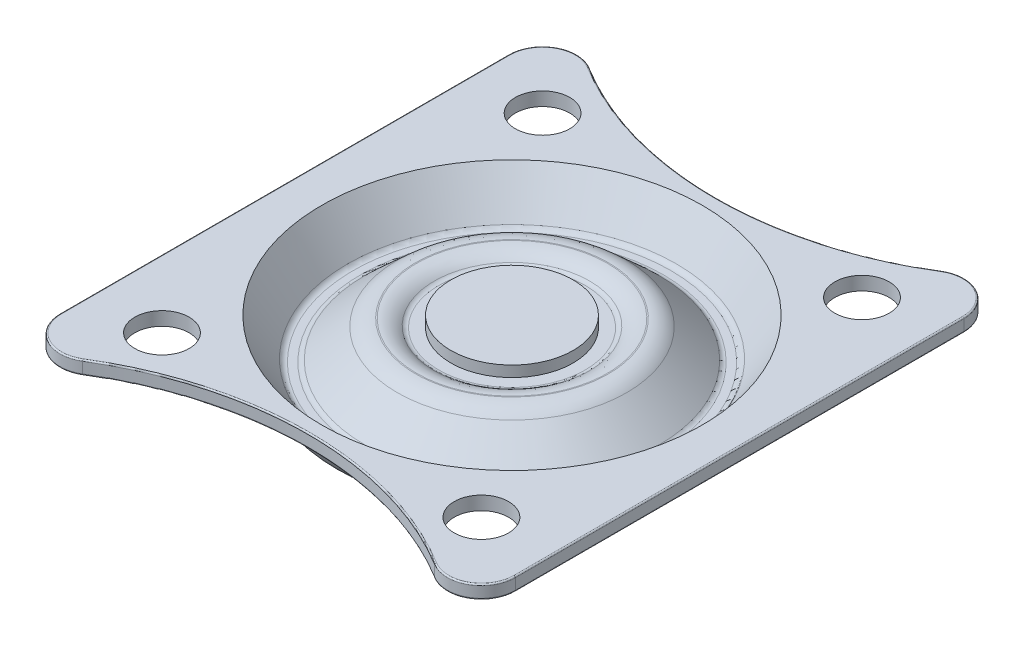
from build123d import *

# Parameters (mm, degrees)
CROQUIS1_R     = 2
EXTRUIR1_DEPTH = 1
CROQUIS4_R     = 14
EXTRUIR3_DEPTH = 26.34881654
REDONDEO1_R    = 2
REDONDEO2_R    = 0.5
REDONDEO3_R    = 2
REDONDEO6_R    = 0.1
CROQUIS2_R     = 4
EXTRUIR5_DEPTH = 26.64298157
CROQUIS5_R     = 4.5
EXTRUIR6_DEPTH = 6
CROQUIS6_R     = 5
EXTRUIR7_DEPTH = 1
REDONDEO7_R    = 0.5
MATRIZC3_COUNT = 16


with BuildPart() as part:
    # Croquis1 → Extruir1 (new body)
    with BuildSketch(Plane(origin=(0, 0, 0), x_dir=(1, 0, 0), z_dir=(0, 1, 0))):
        with BuildLine():
            Line((-16.75, -16.5), (-16.75, 16.5))
            ThreePointArc((-16.75, 16.5), (-15.474235183, 18.679735814), (-12.949001427, 18.634807418))
            ThreePointArc((-12.949001427, 18.634807418), (0, 15), (12.949001427, 18.634807418))
            ThreePointArc((12.949001427, 18.634807418), (15.474235183, 18.679735814), (16.75, 16.5))
            Line((16.75, 16.5), (16.75, -16.5))
            ThreePointArc((16.75, -16.5), (15.474235183, -18.679735814), (12.949001427, -18.634807418))
            ThreePointArc((12.949001427, -18.634807418), (0, -15), (-12.949001427, -18.634807418))
            ThreePointArc((-12.949001427, -18.634807418), (-15.474235183, -18.679735814), (-16.75, -16.5))
        make_face()
        with Locations((-11.75, -14)):
            Circle(CROQUIS1_R, mode=Mode.SUBTRACT)
        with Locations((-11.75, 14)):
            Circle(CROQUIS1_R, mode=Mode.SUBTRACT)
        with Locations((11.75, -14)):
            Circle(CROQUIS1_R, mode=Mode.SUBTRACT)
        with Locations((11.75, 14)):
            Circle(CROQUIS1_R, mode=Mode.SUBTRACT)
    extrude(amount=EXTRUIR1_DEPTH)

    # Croquis4 → Extruir3 (cut, through all)
    with BuildSketch(Plane(origin=(0, 1, 0), x_dir=(1, 0, 0), z_dir=(0, 1, 0))):
        Circle(CROQUIS4_R)
    extrude(amount=-EXTRUIR3_DEPTH, mode=Mode.SUBTRACT)

    # Croquis3 → Revolución1 (revolve)
    with BuildSketch(Plane.XY):
        Polygon((-14.527696455, 0), (-12.476697882, -3), (-10.562471246, -3), (-7.481645354, -0.2), (-6.670899824, -0.2), (-6.471898398, -0.8), (0, -0.8), (0, 0.2), (-5.75, 0.2), (-5.949001427, 0.8), (-7.868175534, 0.8), (-10.949001427, -2), (-11.949001427, -2), (-12.949001427, -0.537297861), (-14, 1), (-14, 0), align=None)
    revolve(axis=Axis((0, 0.2, 0), (0, 1, 0)))

    # Redondeo1
    redondeo1_edges = [part.edges().sort_by_distance(p)[0] for p in [
        (10.562471246, -3, 0),
        (12.476697882, -3, 0),
    ]]
    fillet(redondeo1_edges, radius=REDONDEO1_R)

    # Redondeo2
    redondeo2_edges = [part.edges().sort_by_distance(p)[0] for p in [
        (11.949001427, -2, 0),
        (5.75, 0.2, 0),
        (10.949001427, -2, 0),
    ]]
    fillet(redondeo2_edges, radius=REDONDEO2_R)

    # Redondeo3
    redondeo3_edges = [part.edges().sort_by_distance(p)[0] for p in [
        (5.949001427, 0.8, 0),
        (7.868175534, 0.8, 0),
    ]]
    fillet(redondeo3_edges, radius=REDONDEO3_R)

    # Redondeo6
    redondeo6_edges = [part.edges().sort_by_distance(p)[0] for p in [
        (-16.75, 0, 0),
        (-15.474235183, 0, -18.679735814),
        (0, 0, -15),
        (15.474235183, 0, -18.679735814),
        (16.75, 0, 0),
        (15.474235183, 0, 18.679735814),
        (0, 0, 15),
        (-15.474235183, 1, -18.679735814),
        (0, 1, -15),
        (15.474235183, 1, -18.679735814),
        (16.75, 1, 0),
        (15.474235183, 1, 18.679735814),
        (0, 1, 15),
        (-15.474235183, 1, 18.679735814),
        (-15.474235183, 0, 18.679735814),
        (-16.75, 1, 0),
    ]]
    fillet(redondeo6_edges, radius=REDONDEO6_R)

    # Croquis2 → Extruir5 (cut, through all)
    with BuildSketch(Plane(origin=(0, 1, 0), x_dir=(1, 0, 0), z_dir=(0, 1, 0))):
        Circle(CROQUIS2_R)
    extrude(amount=-EXTRUIR5_DEPTH, mode=Mode.SUBTRACT)

    # Croquis5 → Extruir6 (add)
    with BuildSketch(Plane(origin=(0, 1, 0), x_dir=(1, 0, 0), z_dir=(0, 1, 0))):
        Circle(CROQUIS5_R)
    extrude(amount=-EXTRUIR6_DEPTH)

    # Croquis6 → Extruir7 (add)
    with BuildSketch(Plane.XZ.offset(5)):
        Circle(CROQUIS6_R)
    extrude(amount=EXTRUIR7_DEPTH)

    # Redondeo7
    redondeo7_edges = [part.edges().sort_by_distance(p)[0] for p in [
        (-5, -6, 0),
    ]]
    fillet(redondeo7_edges, radius=REDONDEO7_R)


with BuildPart() as body_2:
    # Croquis7 → Revolución2 (revolve)
    with BuildSketch(Plane.XY):
        with BuildLine():
            Line((-7.580095881, -0.441845671), (-7.580095881, -3.441845671))
            ThreePointArc((-7.580095881, -3.441845671), (-9.080095881, -1.941845671), (-7.580095881, -0.441845671))
        make_face()
    revolve(axis=Axis((-7.580095881, -0.441845671, 0), (0, -1, 0)))


with BuildPart() as matrizc3_1:
    # MatrizC3: pattern copy
    add(body_2.part.rotate(Axis((0, -6.35, 0), (0, 1, 0)), 1 * 360 / MATRIZC3_COUNT))


with BuildPart() as matrizc3_2:
    # MatrizC3: pattern copy
    add(body_2.part.rotate(Axis((0, -6.35, 0), (0, 1, 0)), 2 * 360 / MATRIZC3_COUNT))


with BuildPart() as matrizc3_3:
    # MatrizC3: pattern copy
    add(body_2.part.rotate(Axis((0, -6.35, 0), (0, 1, 0)), 3 * 360 / MATRIZC3_COUNT))


with BuildPart() as matrizc3_4:
    # MatrizC3: pattern copy
    add(body_2.part.rotate(Axis((0, -6.35, 0), (0, 1, 0)), 4 * 360 / MATRIZC3_COUNT))


with BuildPart() as matrizc3_5:
    # MatrizC3: pattern copy
    add(body_2.part.rotate(Axis((0, -6.35, 0), (0, 1, 0)), 5 * 360 / MATRIZC3_COUNT))


with BuildPart() as matrizc3_6:
    # MatrizC3: pattern copy
    add(body_2.part.rotate(Axis((0, -6.35, 0), (0, 1, 0)), 6 * 360 / MATRIZC3_COUNT))


with BuildPart() as matrizc3_7:
    # MatrizC3: pattern copy
    add(body_2.part.rotate(Axis((0, -6.35, 0), (0, 1, 0)), 7 * 360 / MATRIZC3_COUNT))


with BuildPart() as matrizc3_8:
    # MatrizC3: pattern copy
    add(body_2.part.rotate(Axis((0, -6.35, 0), (0, 1, 0)), 8 * 360 / MATRIZC3_COUNT))


with BuildPart() as matrizc3_9:
    # MatrizC3: pattern copy
    add(body_2.part.rotate(Axis((0, -6.35, 0), (0, 1, 0)), 9 * 360 / MATRIZC3_COUNT))


with BuildPart() as matrizc3_10:
    # MatrizC3: pattern copy
    add(body_2.part.rotate(Axis((0, -6.35, 0), (0, 1, 0)), 10 * 360 / MATRIZC3_COUNT))


with BuildPart() as matrizc3_11:
    # MatrizC3: pattern copy
    add(body_2.part.rotate(Axis((0, -6.35, 0), (0, 1, 0)), 11 * 360 / MATRIZC3_COUNT))


with BuildPart() as matrizc3_12:
    # MatrizC3: pattern copy
    add(body_2.part.rotate(Axis((0, -6.35, 0), (0, 1, 0)), 12 * 360 / MATRIZC3_COUNT))


with BuildPart() as matrizc3_13:
    # MatrizC3: pattern copy
    add(body_2.part.rotate(Axis((0, -6.35, 0), (0, 1, 0)), 13 * 360 / MATRIZC3_COUNT))


with BuildPart() as matrizc3_14:
    # MatrizC3: pattern copy
    add(body_2.part.rotate(Axis((0, -6.35, 0), (0, 1, 0)), 14 * 360 / MATRIZC3_COUNT))


with BuildPart() as matrizc3_15:
    # MatrizC3: pattern copy
    add(body_2.part.rotate(Axis((0, -6.35, 0), (0, 1, 0)), 15 * 360 / MATRIZC3_COUNT))


solid = Compound([part.part, body_2.part, matrizc3_1.part, matrizc3_2.part, matrizc3_3.part, matrizc3_4.part, matrizc3_5.part, matrizc3_6.part, matrizc3_7.part, matrizc3_8.part, matrizc3_9.part, matrizc3_10.part, matrizc3_11.part, matrizc3_12.part, matrizc3_13.part, matrizc3_14.part, matrizc3_15.part])
